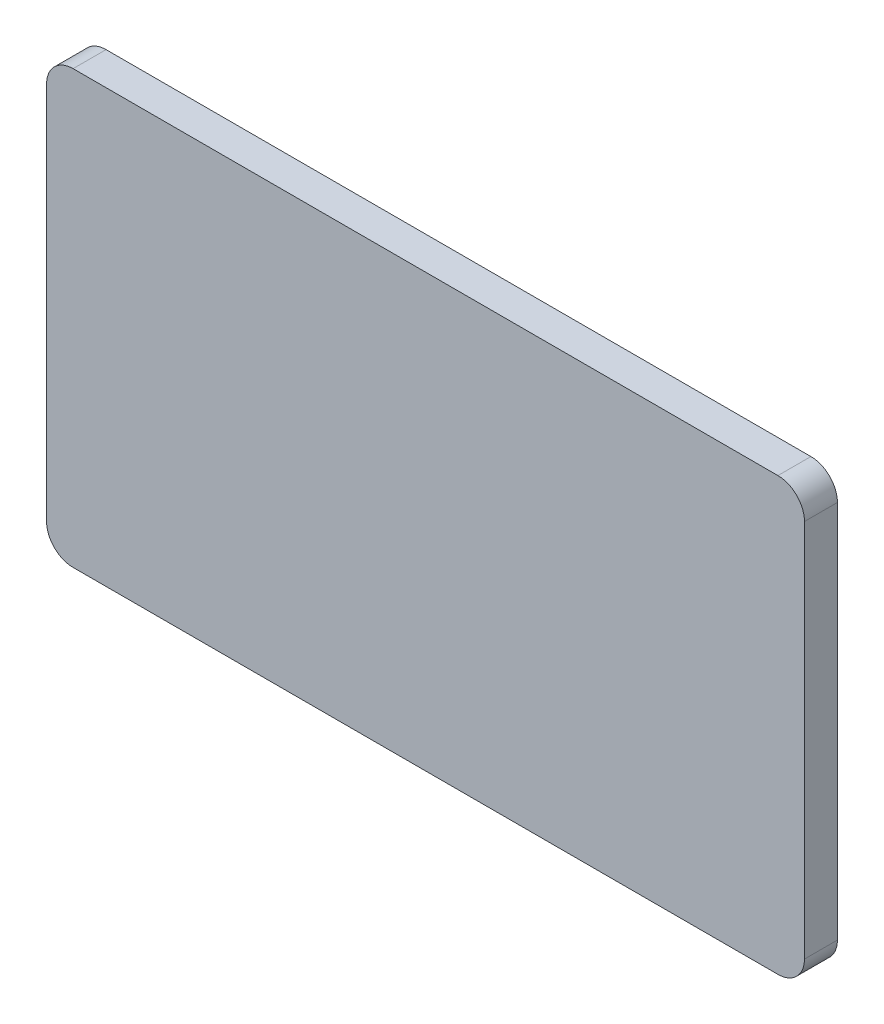
from build123d import *

# Parameters (mm, degrees)
SKETCH1_W           = 200
SKETCH1_H           = 114
BOSS_EXTRUDE1_DEPTH = 8.7
SKETCH1_3_W         = 151
SKETCH1_3_H         = 94
CUT_EXTRUDE1_DEPTH  = 2
FILLET1_R           = 7


with BuildPart() as part:
    # Sketch1 → Boss-Extrude1 (new body)
    with BuildSketch(Plane.XY):
        with Locations((0, 57)):
            Rectangle(SKETCH1_W, SKETCH1_H)
    extrude(amount=BOSS_EXTRUDE1_DEPTH)

    # Sketch1<3> → Cut-Extrude1 (cut)
    with BuildSketch(Plane.XY):
        with Locations((0, 57)):
            Rectangle(SKETCH1_3_W, SKETCH1_3_H)
    extrude(amount=CUT_EXTRUDE1_DEPTH, mode=Mode.SUBTRACT)

    # Fillet1
    fillet1_edges = [part.edges().sort_by_distance(p)[0] for p in [
        (100, 114, 4.35),
        (100, 0, 4.35),
        (-100, 114, 4.35),
        (-100, 0, 4.35),
    ]]
    fillet(fillet1_edges, radius=FILLET1_R)


solid = part.part
